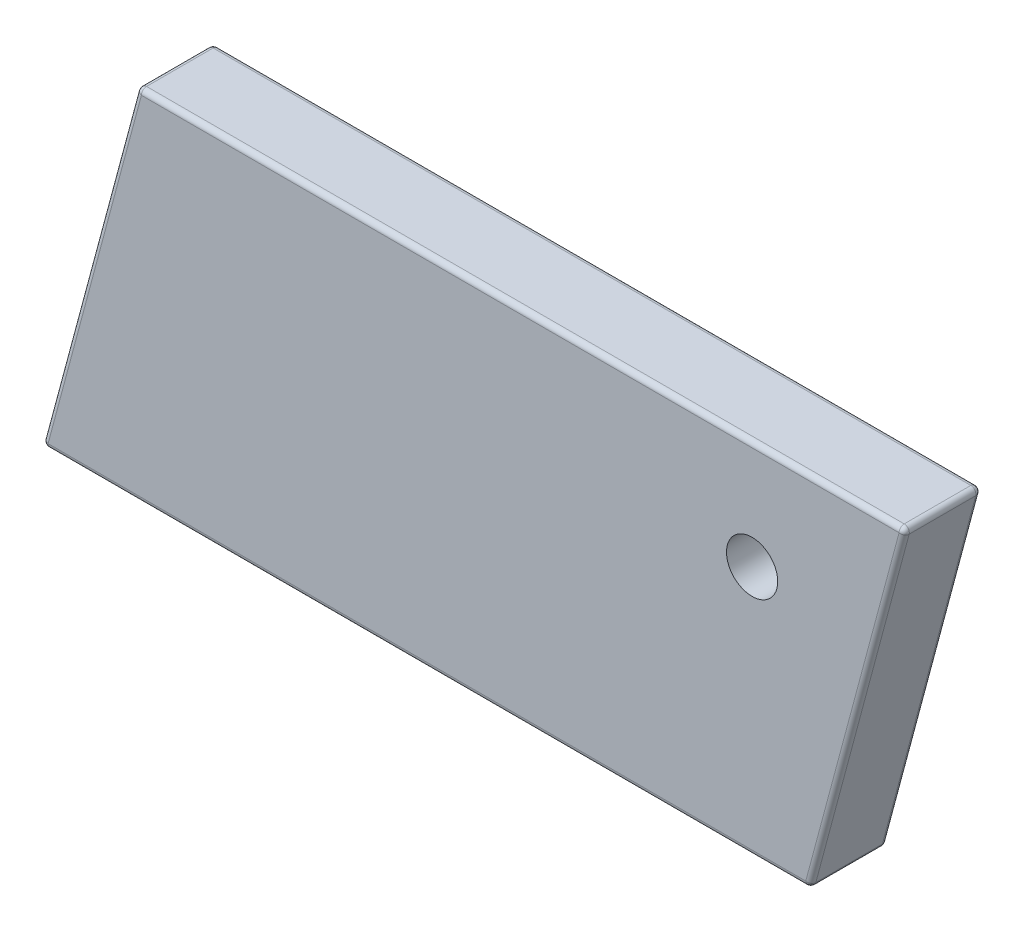
from build123d import *

# Parameters (mm, degrees)
BOSS_EXTRUDE1_DEPTH = 19.05
SKETCH2_R           = 6.35
CUT_EXTRUDE1_DEPTH  = 19.05
FILLET1_R           = 1.27


with BuildPart() as part:
    # Sketch1 → Boss-Extrude1 (new body)
    with BuildSketch(Plane.XY):
        Polygon((0, 0), (23.820683207, 88.9), (214.320683207, 88.9), (190.5, 0), align=None)
    extrude(amount=BOSS_EXTRUDE1_DEPTH)

    # Sketch2 → Cut-Extrude1 (cut)
    with BuildSketch(Plane.XY.offset(19.05)):
        with Locations((176.220683207, 62.083789013)):
            Circle(SKETCH2_R)
    extrude(amount=-CUT_EXTRUDE1_DEPTH, mode=Mode.SUBTRACT)

    # Fillet1
    fillet1_edges = [part.edges().sort_by_distance(p)[0] for p in [
        (119.070683207, 88.9, 19.05),
        (11.910341604, 44.45, 19.05),
        (95.25, 0, 19.05),
        (11.910341604, 44.45, 0),
        (119.070683207, 88.9, 0),
        (202.410341604, 44.45, 0),
        (95.25, 0, 0),
        (0, 0, 9.525),
        (23.820683207, 88.9, 9.525),
        (214.320683207, 88.9, 9.525),
        (190.5, 0, 9.525),
        (202.410341604, 44.45, 19.05),
    ]]
    fillet(fillet1_edges, radius=FILLET1_R)


solid = part.part
